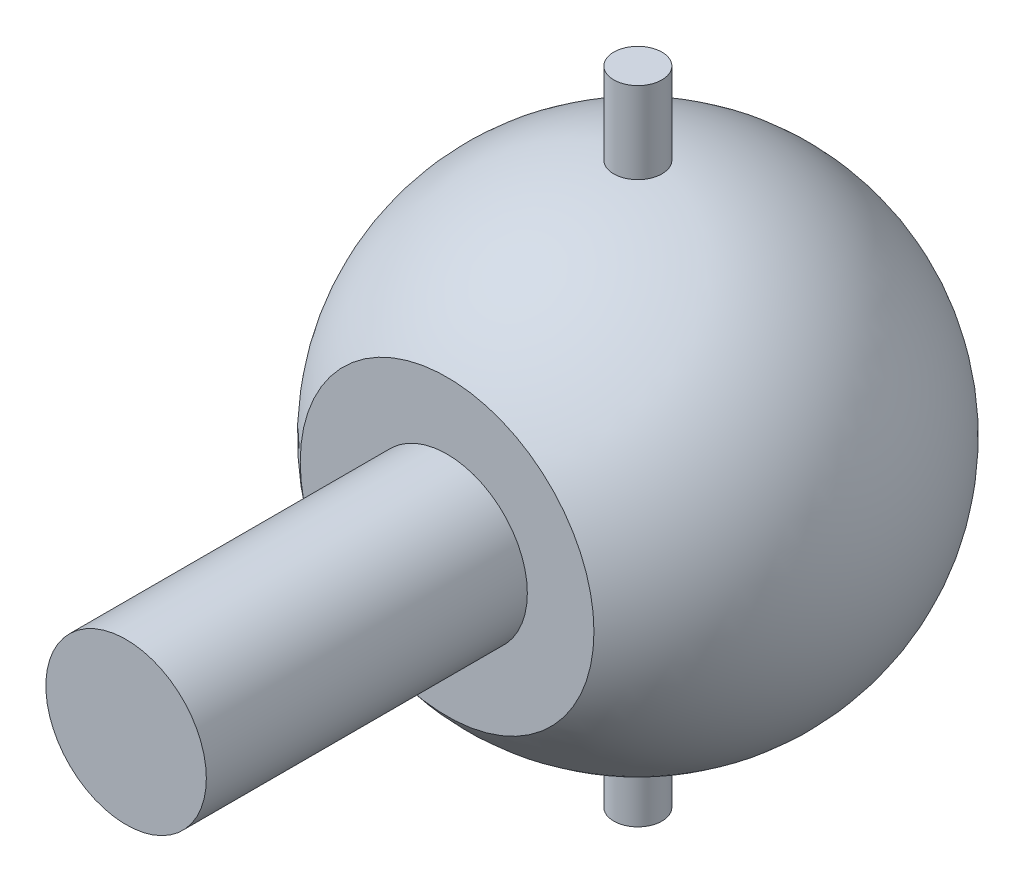
from build123d import *
from build123d.topology import SkipClean

# Parameters (mm, degrees)
CORTAR_EXTRUIR1_DEPTH        = 15
CORTAR_EXTRUIR1_DEPTH_BACK   = 10
CROQUIS2_W                   = 6.229232722
CROQUIS2_H                   = 18.301656292
SALIENTE_EXTRUIR1_DEPTH      = 20
SALIENTE_EXTRUIR1_DEPTH_BACK = 20
CROQUIS3_R                   = 1.5
CROQUIS4_R                   = 5
SALIENTE_EXTRUIR2_DEPTH      = 20


with BuildPart() as part:
    # Croquis1 → Revolución2 (revolve)
    with BuildSketch(Plane.XY):
        with BuildLine():
            Line((0, 15), (0, -15))
            ThreePointArc((0, -15), (15, 0), (0, 15))
        make_face()
    revolve(axis=Axis((0, 15, 0), (0, -1, 0)))

    # Croquis2 → Cortar-Extruir1 (cut, two sides: drawn at the far end of the back side and taken through both)
    with SkipClean():  # the faces are left unmerged after this step: merging them gives an invalid solid
        with BuildSketch(Plane(origin=(0, 0, 0), x_dir=(0, 0, -1), z_dir=(1, 0, 0)).offset(-CORTAR_EXTRUIR1_DEPTH_BACK)):
            with Locations((-15, 0)):
                Rectangle(CROQUIS2_W, CROQUIS2_H)
        extrude(amount=CORTAR_EXTRUIR1_DEPTH + CORTAR_EXTRUIR1_DEPTH_BACK, mode=Mode.SUBTRACT)

    # Croquis3 → Saliente-Extruir1 (add, two sides: drawn at the far end of the back side and taken through both)
    with SkipClean():  # the faces are left unmerged after this step: merging them gives an invalid solid
        with BuildSketch(Plane(origin=(0, 0, 0), x_dir=(1, 0, 0), z_dir=(0, 1, 0)).offset(-SALIENTE_EXTRUIR1_DEPTH_BACK)):
            Circle(CROQUIS3_R)
        extrude(amount=SALIENTE_EXTRUIR1_DEPTH + SALIENTE_EXTRUIR1_DEPTH_BACK)

    # Croquis4 → Saliente-Extruir2 (add)
    with SkipClean():  # the faces are left unmerged after this step: merging them gives an invalid solid
        with BuildSketch(Plane.XY.offset(11.885383639)):
            Circle(CROQUIS4_R)
        extrude(amount=SALIENTE_EXTRUIR2_DEPTH)


solid = part.part
